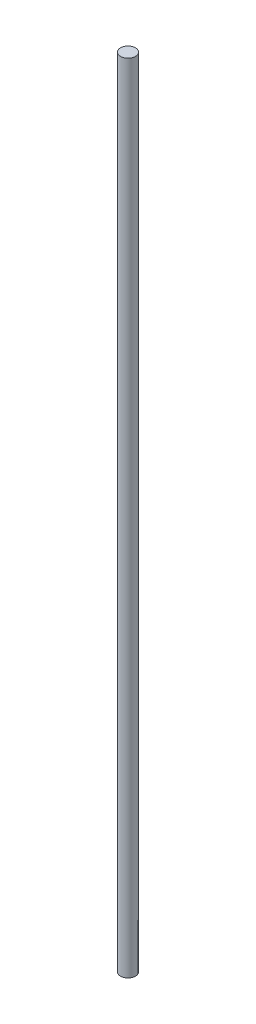
from build123d import *

# Parameters (mm, degrees)
SKETCH2_R           = 4.5
BOSS_EXTRUDE1_DEPTH = 480


with BuildPart() as part:
    # Sketch2 → Boss-Extrude1 (new body)
    with BuildSketch(Plane(origin=(0, 0, 0), x_dir=(1, 0, 0), z_dir=(0, 1, 0))):
        with Locations(Location((0, 0, 0), (0, 0, 270))):
            Circle(SKETCH2_R)
    extrude(amount=BOSS_EXTRUDE1_DEPTH)


solid = part.part
